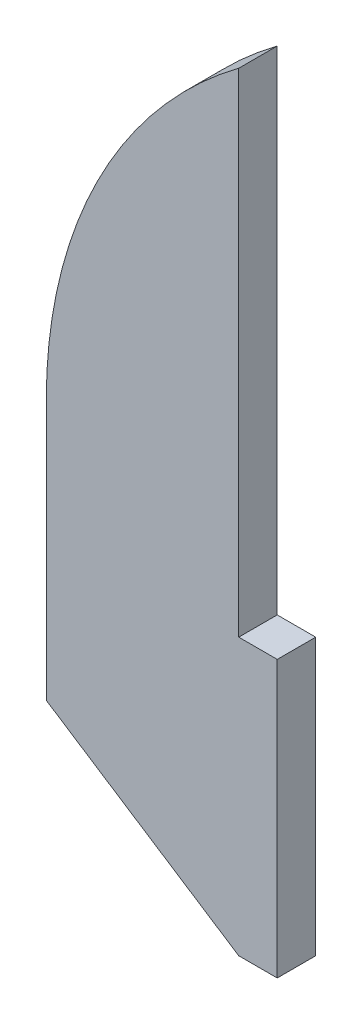
from build123d import *

# Parameters (mm, degrees)
BOSS_EXTRUDE1_DEPTH = 5


with BuildPart() as part:
    # Sketch1 → Boss-Extrude1 (new body)
    with BuildSketch(Plane.XY):
        with BuildLine():
            Line((-12.5, 5), (-12.5, -28.76481017))
            Line((-12.5, -28.76481017), (12.5, -45))
            Line((12.5, -45), (17.5, -45))
            Line((17.5, -45), (17.5, -9.156723451))
            Line((17.5, -9.156723451), (12.5, -9.156723451))
            Line((12.5, -9.156723451), (12.5, 54.843276549))
            ThreePointArc((12.5, 54.843276549), (-5.899738527, 32.880782885), (-12.5, 5))
        make_face()
    extrude(amount=BOSS_EXTRUDE1_DEPTH)


solid = part.part
